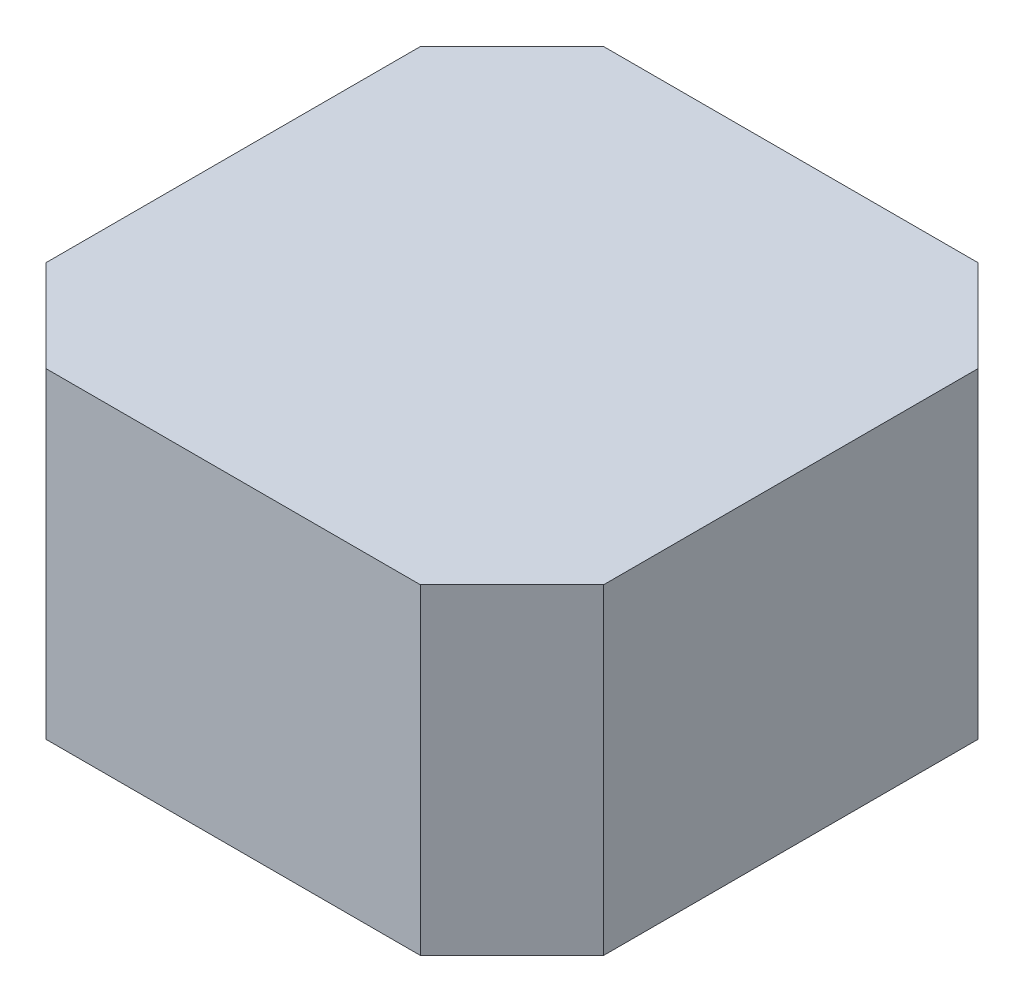
from build123d import *

# Parameters (mm, degrees)
SKETCH2_W           = 6.08
SKETCH2_H           = 6.08
BOSS_EXTRUDE1_DEPTH = 3.5
CHAMFER1_SIZE       = 1


with BuildPart() as part:
    # Sketch2 → Boss-Extrude1 (new body)
    with BuildSketch(Plane(origin=(0, 0, 0), x_dir=(1, 0, 0), z_dir=(0, 1, 0))):
        with Locations((3.04, 3.04)):
            Rectangle(SKETCH2_W, SKETCH2_H)
    extrude(amount=BOSS_EXTRUDE1_DEPTH)

    # Chamfer1
    chamfer1_edges = [part.edges().sort_by_distance(p)[0] for p in [
        (0, 1.75, -6.08),
        (6.08, 1.75, -6.08),
        (6.08, 1.75, 0),
        (0, 1.75, 0),
    ]]
    chamfer(chamfer1_edges, length=CHAMFER1_SIZE)


solid = part.part
